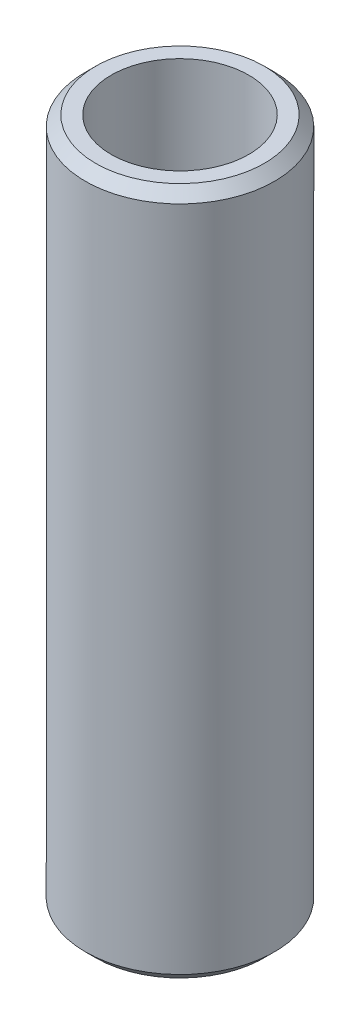
from build123d import *

# Parameters (mm, degrees)
CROQUIS1_R              = 2.75
CROQUIS1_R_2            = 2
SALIENTE_EXTRUIR1_DEPTH = 20
CHAFL_N1_SIZE           = 0.3


with BuildPart() as part:
    # Croquis1 → Saliente-Extruir1 (new body)
    with BuildSketch(Plane(origin=(0, 0, 0), x_dir=(1, 0, 0), z_dir=(0, 1, 0))):
        with Locations(Location((0, 0, 0), (0, 0, 270))):
            Circle(CROQUIS1_R)
        with Locations(Location((0, 0, 0), (0, 0, 270))):
            Circle(CROQUIS1_R_2, mode=Mode.SUBTRACT)
    extrude(amount=SALIENTE_EXTRUIR1_DEPTH)

    # Chaflán1
    chafl_n1_edges = [part.edges().sort_by_distance(p)[0] for p in [
        (0, 0, -2.75),
        (0, 20, -2.75),
    ]]
    chamfer(chafl_n1_edges, length=CHAFL_N1_SIZE)


solid = part.part
